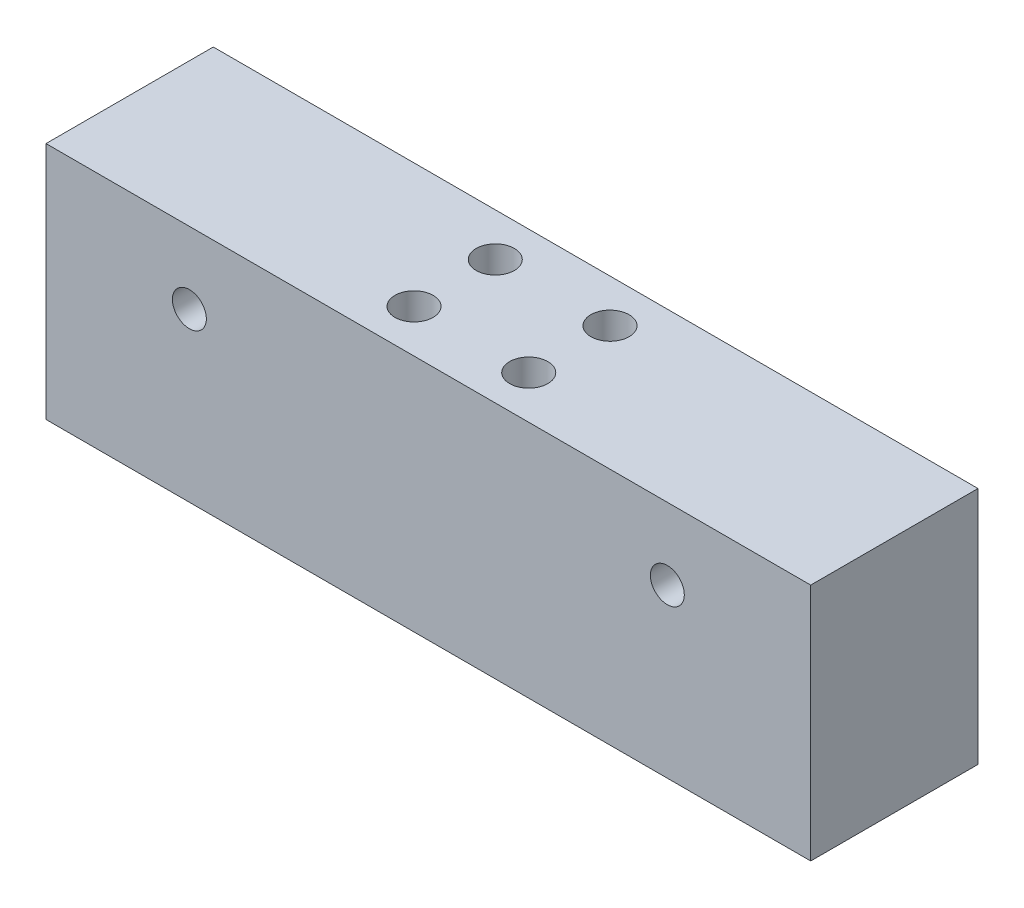
from build123d import *

# Parameters (mm, degrees)
SKETCH2_R           = 3.55
BOSS_EXTRUDE1_DEPTH = 35
SKETCH3_R           = 2.25
CUT_EXTRUDE1_DEPTH  = 110.173579221
SKETCH5_R           = 4
CUT_EXTRUDE3_DEPTH  = 10


with BuildPart() as part:
    # Sketch2 → Boss-Extrude1 (new body)
    with BuildSketch(Plane.XY):
        Polygon((-90.52, 14.235), (-90.52, 64.235), (-25.52, 64.235), (4.48, 64.235), (69.48, 64.235), (69.48, 14.235), align=None)
        with Locations((-60.52, 49.235)):
            Circle(SKETCH2_R, mode=Mode.SUBTRACT)
        with Locations((39.48, 49.235)):
            Circle(SKETCH2_R, mode=Mode.SUBTRACT)
    extrude(amount=BOSS_EXTRUDE1_DEPTH)

    # Sketch3 → Cut-Extrude1 (cut, through all)
    with BuildSketch(Plane.XZ.offset(-14.235)):
        with Locations((-22.52, 26)):
            Circle(SKETCH3_R)
        with Locations((1.48, 26)):
            Circle(SKETCH3_R)
        with Locations((-22.52, 9)):
            Circle(SKETCH3_R)
        with Locations((1.48, 9)):
            Circle(SKETCH3_R)
    extrude(amount=-CUT_EXTRUDE1_DEPTH, mode=Mode.SUBTRACT)

    # Sketch5 → Cut-Extrude3 (cut)
    with BuildSketch(Plane(origin=(0, 64.235, 0), x_dir=(1, 0, 0), z_dir=(0, 1, 0))):
        with Locations(Location((-22.52, -9, 0), (0, 0, 270))):
            Circle(SKETCH5_R)
        with Locations(Location((-22.52, -26, 0), (0, 0, 270))):
            Circle(SKETCH5_R)
        with Locations(Location((1.48, -26, 0), (0, 0, 270))):
            Circle(SKETCH5_R)
        with Locations(Location((1.48, -9, 0), (0, 0, 270))):
            Circle(SKETCH5_R)
    extrude(amount=-CUT_EXTRUDE3_DEPTH, mode=Mode.SUBTRACT)


solid = part.part
